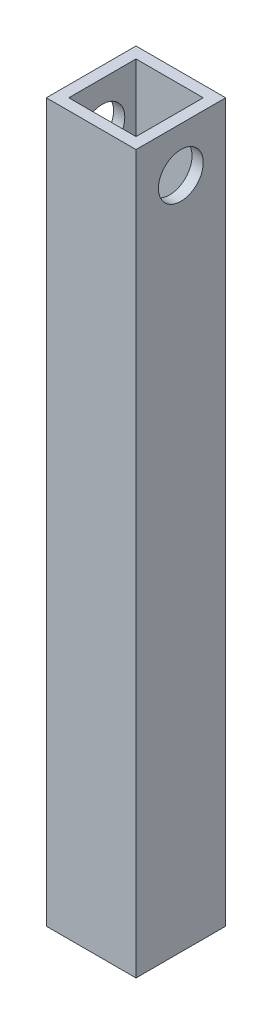
from build123d import *

# Parameters (mm, degrees)
SKETCH1_W           = 25.4
SKETCH1_H           = 25.4
SKETCH1_W_2         = 19.05
SKETCH1_H_2         = 19.05
EXTRUDE_THIN1_DEPTH = 203.2
SKETCH2_R           = 6.35
CUT_EXTRUDE1_DEPTH  = 206.174779152


with BuildPart() as part:
    # Sketch1 → Extrude-Thin1 (new body)
    with BuildSketch(Plane(origin=(0, 0, 0), x_dir=(1, 0, 0), z_dir=(0, 1, 0))):
        Rectangle(SKETCH1_W, SKETCH1_H)
        Rectangle(SKETCH1_W_2, SKETCH1_H_2, mode=Mode.SUBTRACT)
    extrude(amount=EXTRUDE_THIN1_DEPTH)

    # Sketch2 → Cut-Extrude1 (cut, through all)
    with BuildSketch(Plane(origin=(12.7, 0, 0), x_dir=(0, 0, -1), z_dir=(1, 0, 0))):
        with Locations((0, 190.5)):
            Circle(SKETCH2_R)
    extrude(amount=-CUT_EXTRUDE1_DEPTH, mode=Mode.SUBTRACT)


solid = part.part
